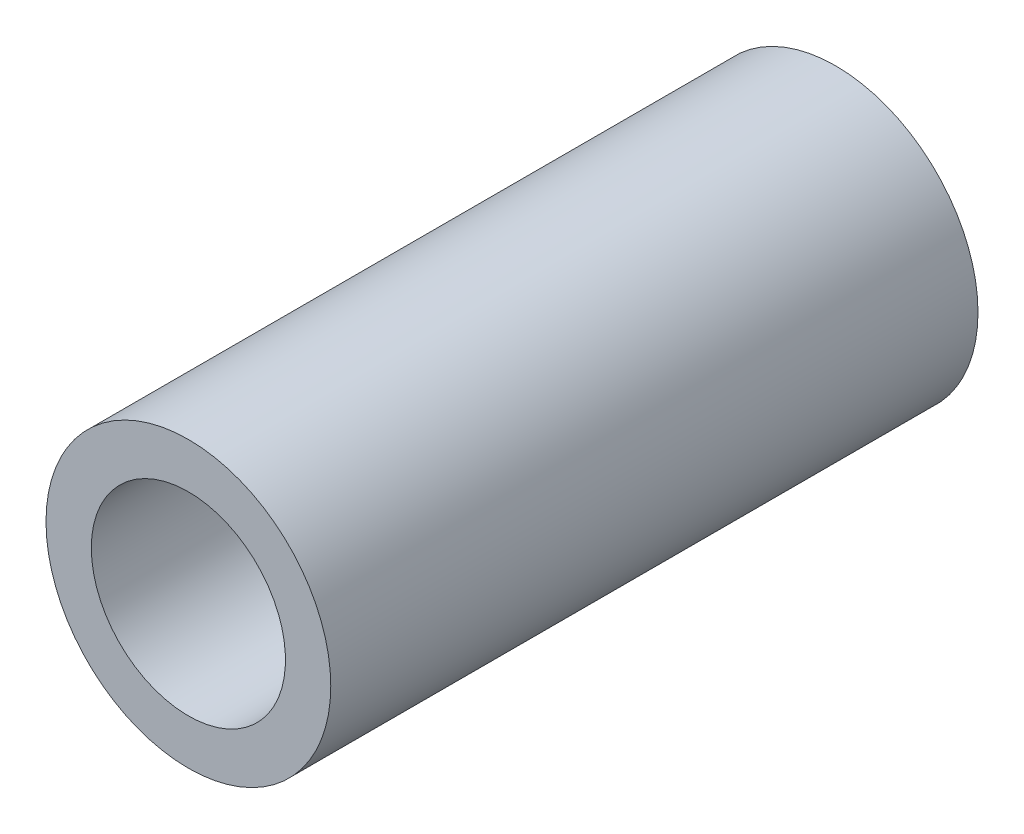
from build123d import *

# Parameters (mm, degrees)
ESQUISSE1_R             = 22
BOSS_EXTRU_1_DEPTH      = 100
ESQUISSE2_R             = 15
ENL_V_MAT_EXTRU_1_DEPTH = 100


with BuildPart() as part:
    # Esquisse1 → Boss.-Extru.1 (new body)
    with BuildSketch(Plane.XY):
        Circle(ESQUISSE1_R)
    extrude(amount=BOSS_EXTRU_1_DEPTH)

    # Esquisse2 → Enlèv. mat.-Extru.1 (cut)
    with BuildSketch(Plane(origin=(0, 0, 0), x_dir=(-1, 0, 0), z_dir=(0, 0, -1))):
        Circle(ESQUISSE2_R)
    extrude(amount=-ENL_V_MAT_EXTRU_1_DEPTH, mode=Mode.SUBTRACT)


solid = part.part
